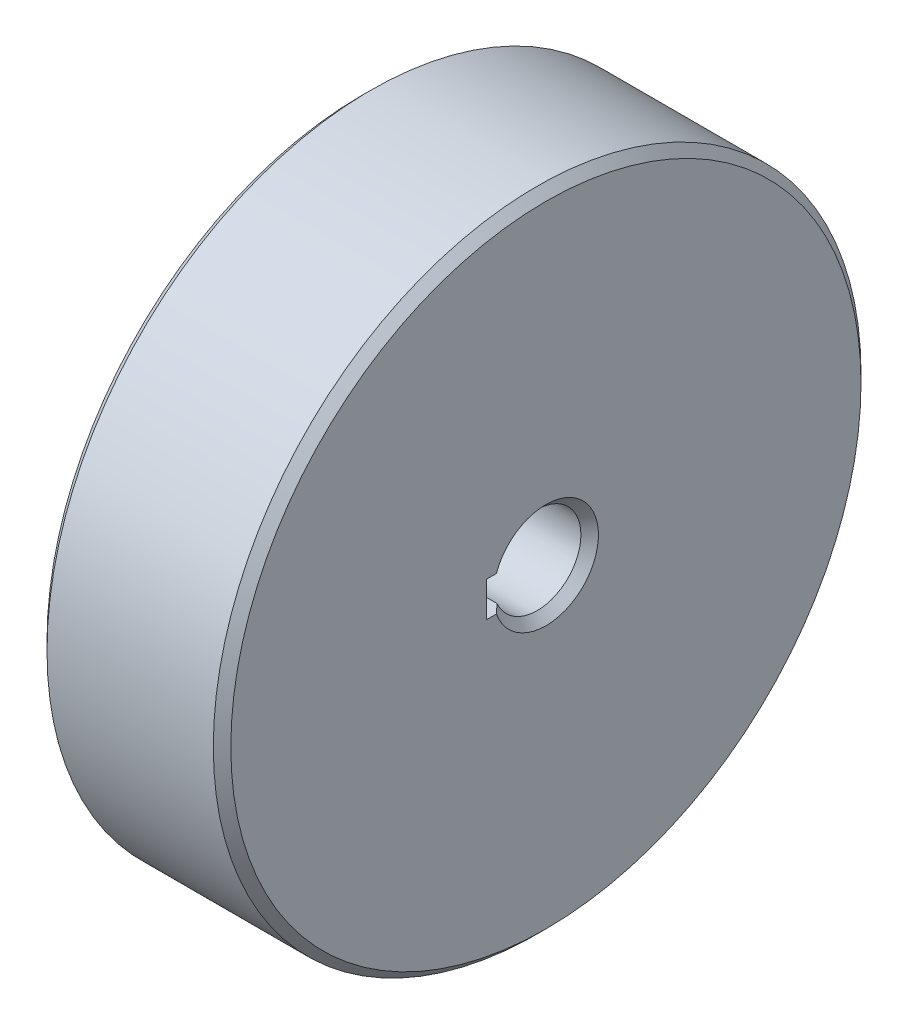
from build123d import *

# Parameters (mm, degrees)
SKETCH1_W          = 21
SKETCH1_H          = 32
CUT_EXTRUDE2_DEPTH = 57.382621436
CHAMFER1_SIZE      = 1


with BuildPart() as part:
    # Sketch1 → Revolve1 (revolve)
    with BuildSketch(Plane(origin=(0, 0, 0), x_dir=(1, 0, 0), z_dir=(0, 1, 0))):
        with Locations((10.5, -21)):
            Rectangle(SKETCH1_W, SKETCH1_H)
    revolve(axis=Axis((0, 0, 0), (1, 0, 0)))

    # Sketch2 → Cut-Extrude2 (cut, through all)
    with BuildSketch(Plane(origin=(0, 0, 0), x_dir=(0, 0, -1), z_dir=(1, 0, 0))):
        with BuildLine():
            Line((-4.582575695, -2), (-6.8, -2))
            Line((-6.8, -2), (-6.8, 2))
            Line((-6.8, 2), (-4.582575695, 2))
            ThreePointArc((-4.582575695, 2), (-5, 0), (-4.582575695, -2))
        make_face()
    extrude(amount=CUT_EXTRUDE2_DEPTH, mode=Mode.SUBTRACT)

    # Chamfer1
    chamfer1_edges = [part.edges().sort_by_distance(p)[0] for p in [
        (0, 0, -37),
        (21, 0, -37),
        (21, 0, -5),
        (0, 0, -5),
    ]]
    chamfer(chamfer1_edges, length=CHAMFER1_SIZE)


solid = part.part
